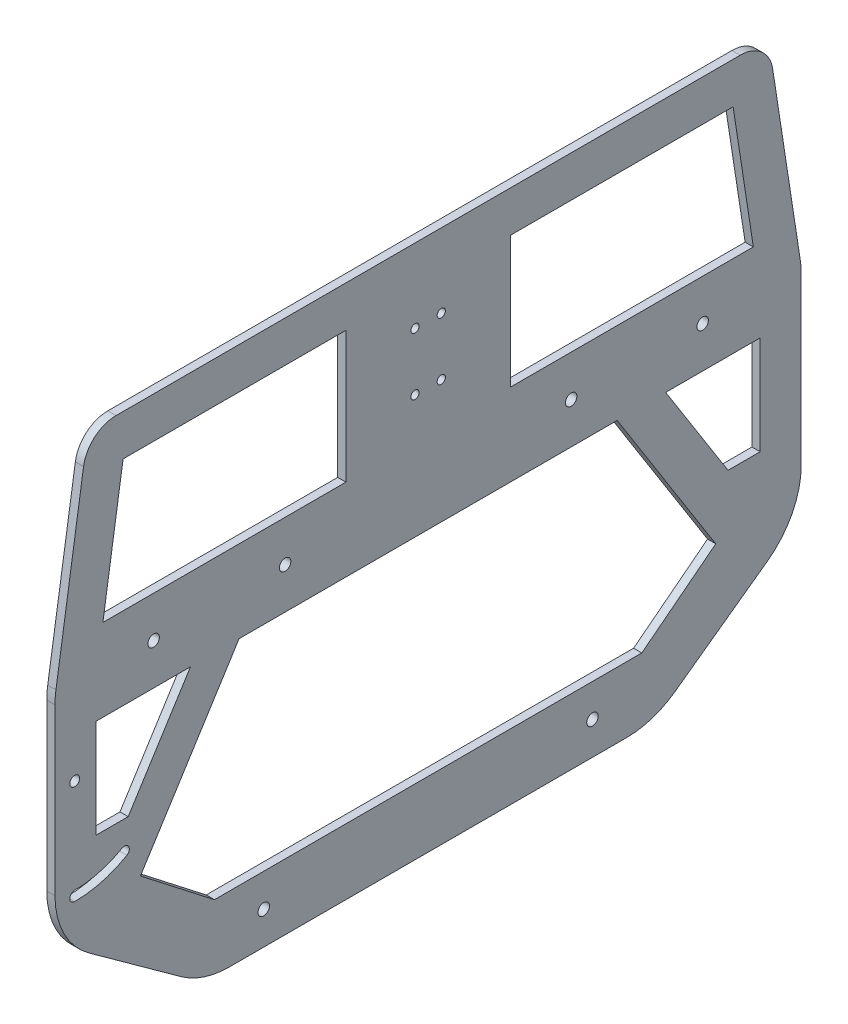
from build123d import *

# Parameters (mm, degrees)
SKETCH_1_R      = 2.5
SKETCH_1_R_2    = 3.5
SKETCH_1_R_3    = 3
EXTRUDE_1_DEPTH = 5
FILLET_1_R      = 20
FILLET_2_R      = 20
FILLET_3_R      = 50
FILLET_4_R      = 50
FILLET_5_R      = 50
FILLET_6_R      = 50
FILLET_7_R      = 50
FILLET_8_R      = 50


with BuildPart() as part:
    # 草图1 → 凸台-拉伸1 (new body)
    with BuildSketch(Plane(origin=(4.7625, 0, 0), x_dir=(0, 0, -1), z_dir=(1, 0, 0))):
        Polygon((-227, 0), (-227, -130), (-137, -195), (137, -195), (227, -130), (227, 0), (207, 130), (-207, 130), align=None)
        with Locations((-8, 85)):
            Circle(SKETCH_1_R, mode=Mode.SUBTRACT)
        with Locations((-8, 50)):
            Circle(SKETCH_1_R, mode=Mode.SUBTRACT)
        with Locations(Location((8, 50, 0), (0, 0, 180))):
            Circle(SKETCH_1_R, mode=Mode.SUBTRACT)
        with Locations(Location((8, 85, 0), (0, 0, 180))):
            Circle(SKETCH_1_R, mode=Mode.SUBTRACT)
        with Locations((-100, -175)):
            Circle(SKETCH_1_R_2, mode=Mode.SUBTRACT)
        with Locations((100, -175)):
            Circle(SKETCH_1_R_2, mode=Mode.SUBTRACT)
        with Locations(Location((167, 0, 0), (0, 0, 180))):
            Circle(SKETCH_1_R_2, mode=Mode.SUBTRACT)
        with Locations(Location((87, 0, 0), (0, 0, 180))):
            Circle(SKETCH_1_R_2, mode=Mode.SUBTRACT)
        with Locations(Location((-87, 0, 0), (0, 0, 180))):
            Circle(SKETCH_1_R_2, mode=Mode.SUBTRACT)
        with Locations(Location((-167, 0, 0), (0, 0, 180))):
            Circle(SKETCH_1_R_2, mode=Mode.SUBTRACT)
        with Locations(Location((-215, -50, 0), (0, 0, 180))):
            Circle(SKETCH_1_R_3, mode=Mode.SUBTRACT)
        Polygon((130, -155), (-130, -155), (-175, -120), (-115, -25), (115, -25), (175, -120), align=None, mode=Mode.SUBTRACT)
        Polygon((-144.568690861, -25), (-202, -25), (-202, -85), (-182.463427703, -85), align=None, mode=Mode.SUBTRACT)
        Polygon((182.463427703, -85), (144.568690861, -25), (202, -25), (202, -85), align=None, mode=Mode.SUBTRACT)
        Polygon((-185.552026081, 105), (-50, 105), (-50, 25), (-197.859718389, 25), align=None, mode=Mode.SUBTRACT)
        Polygon((50, 105), (50, 25), (197.859718389, 25), (185.552026081, 105), align=None, mode=Mode.SUBTRACT)
        with BuildLine():
            ThreePointArc((-215, -113.5), (-218, -110.5), (-215, -107.5))
            ThreePointArc((-215, -107.5), (-200.117904907, -105.540735012), (-186.25, -99.796460718))
            ThreePointArc((-186.25, -99.796460718), (-182.151923789, -100.894536929), (-183.25, -104.99261314))
            ThreePointArc((-183.25, -104.99261314), (-198.564990636, -111.336289969), (-215, -113.5))
        make_face(mode=Mode.SUBTRACT)
    extrude(amount=-EXTRUDE_1_DEPTH)

    # 圆角1
    fillet_1_edges = [part.edges().sort_by_distance(p)[0] for p in [
        (2.2625, 130, 207),
    ]]
    fillet(fillet_1_edges, radius=FILLET_1_R)

    # 圆角2
    fillet_2_edges = [part.edges().sort_by_distance(p)[0] for p in [
        (2.2625, 130, -207),
    ]]
    fillet(fillet_2_edges, radius=FILLET_2_R)

    # 圆角3
    fillet_3_edges = [part.edges().sort_by_distance(p)[0] for p in [
        (2.2625, 0, 227),
    ]]
    fillet(fillet_3_edges, radius=FILLET_3_R)

    # 圆角4
    fillet_4_edges = [part.edges().sort_by_distance(p)[0] for p in [
        (2.2625, 0, -227),
    ]]
    fillet(fillet_4_edges, radius=FILLET_4_R)

    # 圆角5
    fillet_5_edges = [part.edges().sort_by_distance(p)[0] for p in [
        (2.2625, -130, 227),
    ]]
    fillet(fillet_5_edges, radius=FILLET_5_R)

    # 圆角6
    fillet_6_edges = [part.edges().sort_by_distance(p)[0] for p in [
        (2.2625, -195, 137),
    ]]
    fillet(fillet_6_edges, radius=FILLET_6_R)

    # 圆角7
    fillet_7_edges = [part.edges().sort_by_distance(p)[0] for p in [
        (2.2625, -195, -137),
    ]]
    fillet(fillet_7_edges, radius=FILLET_7_R)

    # 圆角8
    fillet_8_edges = [part.edges().sort_by_distance(p)[0] for p in [
        (2.2625, -130, -227),
    ]]
    fillet(fillet_8_edges, radius=FILLET_8_R)


solid = part.part
